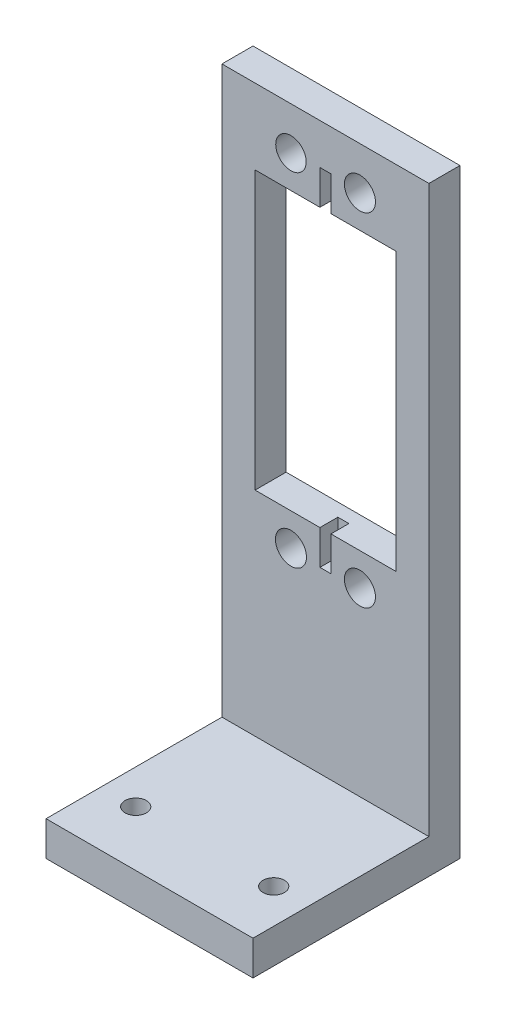
from build123d import *

# Parameters (mm, degrees)
SKETCH_1_W          = 30
SKETCH_1_H          = 62
SKETCH_1_W_2        = 20.4
SKETCH_1_H_2        = 40.2
EXTRUDE_1_DEPTH     = 4.5
SKETCH_3_R          = 2.25
SKETCH_3_R_2        = 2.20649786
CUT_EXTRUDE_1_DEPTH = 35.731109974
SKETCH_5_W          = 30
SKETCH_5_H          = 4.5
EXTRUDE_3_DEPTH     = 20
SKETCH_6_W          = 30
SKETCH_6_H          = 30
EXTRUDE_4_DEPTH     = 5
SKETCH_7_R          = 1.55
CUT_EXTRUDE_2_DEPTH = 94.241621608
SKETCH_8_W          = 1.6
SKETCH_8_H          = 5
CUT_EXTRUDE_3_DEPTH = 2.6


with BuildPart() as part:
    # 草图1 → 凸台-拉伸1 (new body)
    with BuildSketch(Plane.XY):
        Rectangle(SKETCH_1_W, SKETCH_1_H)
        Rectangle(SKETCH_1_W_2, SKETCH_1_H_2, mode=Mode.SUBTRACT)
    extrude(amount=EXTRUDE_1_DEPTH)

    # 草图3 → 切除-拉伸1 (cut, through all)
    with BuildSketch(Plane(origin=(0, 0, 0), x_dir=(-1, 0, 0), z_dir=(0, 0, -1))):
        with Locations((-5, -24.8)):
            Circle(SKETCH_3_R)
        with Locations((5, -24.8)):
            Circle(SKETCH_3_R)
        with Locations((-5, 24.8)):
            Circle(SKETCH_3_R)
        with Locations((5, 24.8)):
            Circle(SKETCH_3_R_2)
    extrude(amount=-CUT_EXTRUDE_1_DEPTH, mode=Mode.SUBTRACT)

    # 草图5 → 凸台-拉伸3 (add)
    with BuildSketch(Plane.XZ.offset(31)):
        with Locations((0, 2.25)):
            Rectangle(SKETCH_5_W, SKETCH_5_H)
    extrude(amount=EXTRUDE_3_DEPTH)

    # 草图6 → 凸台-拉伸4 (add)
    with BuildSketch(Plane.XZ.offset(51)):
        with Locations((0, 15)):
            Rectangle(SKETCH_6_W, SKETCH_6_H)
    extrude(amount=EXTRUDE_4_DEPTH)

    # 草图7 → 切除-拉伸2 (cut, through all)
    with BuildSketch(Plane.XZ.offset(56)):
        with Locations(Location((10, 22, 0), (0, 0, 270))):
            Circle(SKETCH_7_R)
        with Locations(Location((-10, 22, 0), (0, 0, 270))):
            Circle(SKETCH_7_R)
    extrude(amount=-CUT_EXTRUDE_2_DEPTH, mode=Mode.SUBTRACT)

    # 草图8 → 切除-拉伸3 (cut)
    with BuildSketch(Plane.XY.offset(4.5)):
        with Locations((0, -22.6)):
            Rectangle(SKETCH_8_W, SKETCH_8_H)
        with Locations((0, 22.6)):
            Rectangle(SKETCH_8_W, SKETCH_8_H)
    extrude(amount=-CUT_EXTRUDE_3_DEPTH, mode=Mode.SUBTRACT)


solid = part.part
